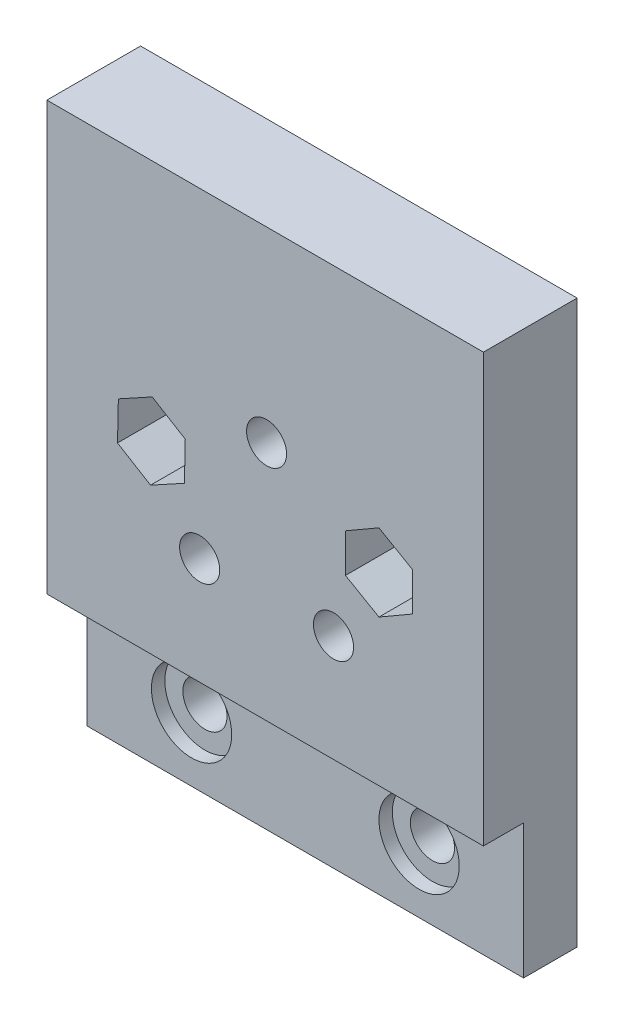
from build123d import *

# Parameters (mm, degrees)
SKICA1_W                 = 32.614180818
SKICA1_H                 = 41.995577694
SKICA1_R                 = 1.649999753
SKICA1_R_2               = 1.649999979
SKICA1_R_3               = 1.649999826
SKICA1_R_4               = 1.650000122
P_IDAT_VYSUNUT_M1_DEPTH  = 4
ODEBRAT_VYSUNUT_M1_DEPTH = 3
SKICA3_W                 = 32.614180818
SKICA3_H                 = 31.955890059
P_IDAT_VYSUNUT_M2_DEPTH  = 3
SKICA4_R                 = 1.649999753
SKICA4_R_2               = 1.649999979
P_IDAT_VYSUNUT_M3_DEPTH  = 1
SKICA5_R                 = 3
ODEBRAT_VYSUNUT_M2_DEPTH = 1
SKICA6_R                 = 1.5
SKICA6_R_2               = 1.495454726
ODEBRAT_VYSUNUT_M3_DEPTH = 7
SKICA7_R                 = 3.25
ODEBRAT_VYSUNUT_M4_DEPTH = 4


with BuildPart() as part:
    # Skica1 → Přidat vysunutím1 (new body)
    with BuildSketch(Plane.XY):
        with Locations((0, 6.659801208)):
            Rectangle(SKICA1_W, SKICA1_H)
        with Locations((-8.49999961, 9.500000046)):
            Circle(SKICA1_R, mode=Mode.SUBTRACT)
        with Locations((8.499999866, 9.50000039)):
            Circle(SKICA1_R_2, mode=Mode.SUBTRACT)
        with Locations((8.500000308, -9.499999987)):
            Circle(SKICA1_R_3, mode=Mode.SUBTRACT)
        with Locations((-8.499999537, -9.500000426)):
            Circle(SKICA1_R_4, mode=Mode.SUBTRACT)
    extrude(amount=P_IDAT_VYSUNUT_M1_DEPTH)

    # Skica2 → Odebrat vysunutím1 (cut)
    with BuildSketch(Plane.XY.offset(4)):
        Polygon((-8.437315747, 12.386070743), (-10.968068219, 10.997321212), (-11.030752082, 8.111250516), (-8.562683473, 6.61392935), (-6.031931001, 8.002678881), (-5.969247138, 10.888749577), align=None)
        Polygon((8.499999866, 12.386751736), (5.999999866, 10.943376063), (5.999999866, 8.056624717), (8.499999866, 6.613249044), (10.999999866, 8.056624717), (10.999999866, 10.943376063), align=None)
    extrude(amount=-ODEBRAT_VYSUNUT_M1_DEPTH, mode=Mode.SUBTRACT)

    # Skica3 → Přidat vysunutím2 (add)
    with BuildSketch(Plane.XY.offset(4)):
        with Locations((0, 11.679645025)):
            Rectangle(SKICA3_W, SKICA3_H)
        Polygon((-8.437315747, 12.386070743), (-10.968068219, 10.997321212), (-11.030752082, 8.111250516), (-8.562683473, 6.61392935), (-6.031931001, 8.002678881), (-5.969247138, 10.888749577), align=None, mode=Mode.SUBTRACT)
        Polygon((10.999999866, 10.943376063), (8.499999866, 12.386751736), (5.999999866, 10.943376063), (5.999999866, 8.056624717), (8.499999866, 6.613249044), (10.999999866, 8.056624717), align=None, mode=Mode.SUBTRACT)
    extrude(amount=P_IDAT_VYSUNUT_M2_DEPTH)

    # Skica4 → Přidat vysunutím3 (add)
    # profile 1 of 2: a face of its own
    with BuildSketch(Plane.XY.offset(1)):
        Polygon((-5.969247138, 10.888749577), (-8.437315747, 12.386070743), (-10.968068219, 10.997321212), (-11.030752082, 8.111250516), (-8.562683473, 6.61392935), (-6.031931001, 8.002678881), align=None)
        with Locations((-8.49999961, 9.500000046)):
            Circle(SKICA4_R, mode=Mode.SUBTRACT)
    # profile 2 of 2: a face of its own
    with BuildSketch(Plane.XY.offset(1)):
        Polygon((10.999999866, 10.943376063), (8.499999866, 12.386751736), (5.999999866, 10.943376063), (5.999999866, 8.056624717), (8.499999866, 6.613249044), (10.999999866, 8.056624717), align=None)
        with Locations((8.499999866, 9.50000039)):
            Circle(SKICA4_R_2, mode=Mode.SUBTRACT)
    extrude(amount=P_IDAT_VYSUNUT_M3_DEPTH)

    # Skica5 → Odebrat vysunutím2 (cut)
    with BuildSketch(Plane.XY.offset(4)):
        with Locations((8.500000308, -9.499999987)):
            Circle(SKICA5_R)
        with Locations((-8.499999537, -9.500000426)):
            Circle(SKICA5_R)
    extrude(amount=-ODEBRAT_VYSUNUT_M2_DEPTH, mode=Mode.SUBTRACT)

    # Skica6 → Odebrat vysunutím3 (cut)
    with BuildSketch(Plane.XY.offset(7)):
        with Locations((5.107090409, 3.701699996)):
            Circle(SKICA6_R)
        with Locations((-4.892909591, 3.701699996)):
            Circle(SKICA6_R)
        with Locations((0.107090409, 13.701699996)):
            Circle(SKICA6_R_2)
    extrude(amount=-ODEBRAT_VYSUNUT_M3_DEPTH, mode=Mode.SUBTRACT)

    # Skica7 → Odebrat vysunutím4 (cut)
    with BuildSketch(Plane(origin=(0, 0, 0), x_dir=(-1, 0, 0), z_dir=(0, 0, -1))):
        with Locations((4.892909591, 3.701699996)):
            Circle(SKICA7_R)
        with Locations((-5.107090409, 3.701699996)):
            Circle(SKICA7_R)
        with Locations((-0.107090409, 13.701699996)):
            Circle(SKICA7_R)
    extrude(amount=-ODEBRAT_VYSUNUT_M4_DEPTH, mode=Mode.SUBTRACT)


solid = part.part
